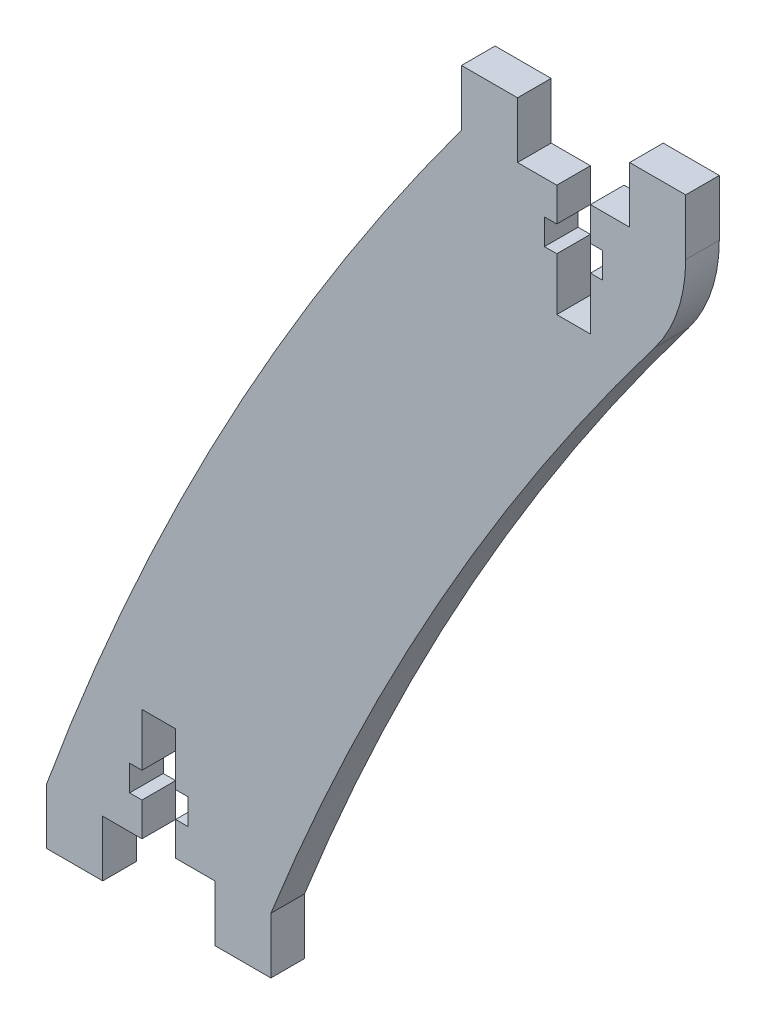
from build123d import *

# Parameters (mm, degrees)
BOSS_EXTRUDE1_DEPTH = 3


with BuildPart() as part:
    # Sketch1 → Boss-Extrude1 (new body)
    with BuildSketch(Plane.XY):
        with BuildLine():
            Line((61.5, 69), (65, 69))
            Line((65, 69), (65, 74))
            Line((65, 74), (70, 74))
            Line((70, 74), (70, 69))
            ThreePointArc((70, 69), (69.294335516, 64.693743781), (67.25115741, 60.837939298))
            ThreePointArc((67.25115741, 60.837939298), (48.039496813, 31.593413098), (33, 0))
            Line((33, 0), (33, -5))
            Line((33, -5), (28, -5))
            Line((28, -5), (28, 0))
            Line((28, 0), (24.5, 0))
            Line((24.5, 0), (24.5, 3))
            Line((24.5, 3), (25.6, 3))
            Line((25.6, 3), (25.6, 5.3))
            Line((25.6, 5.3), (24.5, 5.3))
            Line((24.5, 5.3), (24.5, 10))
            Line((24.5, 10), (21.5, 10))
            Line((21.5, 10), (21.5, 5.3))
            Line((21.5, 5.3), (20.4, 5.3))
            Line((20.4, 5.3), (20.4, 3))
            Line((20.4, 3), (21.5, 3))
            Line((21.5, 3), (21.5, 0))
            Line((21.5, 0), (18, 0))
            Line((18, 0), (18, -5))
            Line((18, -5), (13, -5))
            Line((13, -5), (13, 0))
            ThreePointArc((13, 0), (29.026516524, 35.826360704), (50, 69))
            Line((50, 69), (50, 74))
            Line((50, 74), (55, 74))
            Line((55, 74), (55, 69))
            Line((55, 69), (58.5, 69))
            Line((58.5, 69), (58.5, 66))
            Line((58.5, 66), (57.4, 66))
            Line((57.4, 66), (57.4, 63.7))
            Line((57.4, 63.7), (58.5, 63.7))
            Line((58.5, 63.7), (58.5, 59))
            Line((58.5, 59), (61.5, 59))
            Line((61.5, 59), (61.5, 63.7))
            Line((61.5, 63.7), (62.6, 63.7))
            Line((62.6, 63.7), (62.6, 66))
            Line((62.6, 66), (61.5, 66))
            Line((61.5, 66), (61.5, 69))
        make_face()
    extrude(amount=BOSS_EXTRUDE1_DEPTH)


solid = part.part
